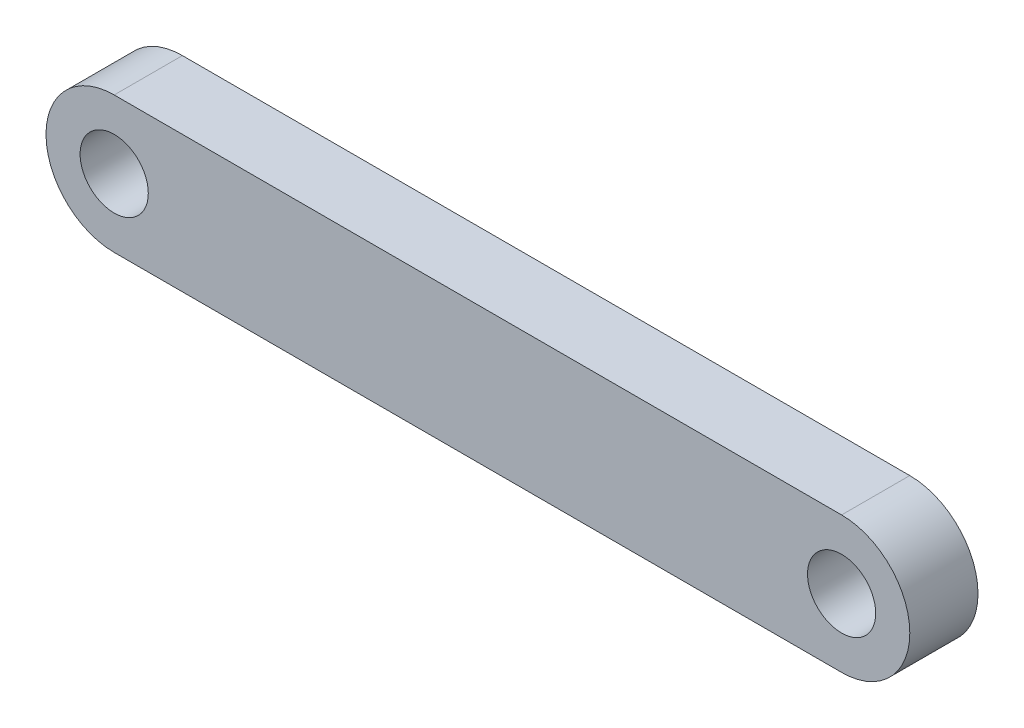
from build123d import *

# Parameters (mm, degrees)
SKETCH2_R           = 1.5
BOSS_EXTRUDE1_DEPTH = 3


with BuildPart() as part:
    # Sketch2 → Boss-Extrude1 (new body)
    with BuildSketch(Plane.XY):
        with BuildLine():
            Line((-32, 3), (0, 3))
            ThreePointArc((0, 3), (3, 0), (0, -3))
            Line((0, -3), (-32, -3))
            ThreePointArc((-32, -3), (-35, 0), (-32, 3))
        make_face()
        with Locations((-32, 0)):
            Circle(SKETCH2_R, mode=Mode.SUBTRACT)
        Circle(SKETCH2_R, mode=Mode.SUBTRACT)
    extrude(amount=BOSS_EXTRUDE1_DEPTH)


solid = part.part
